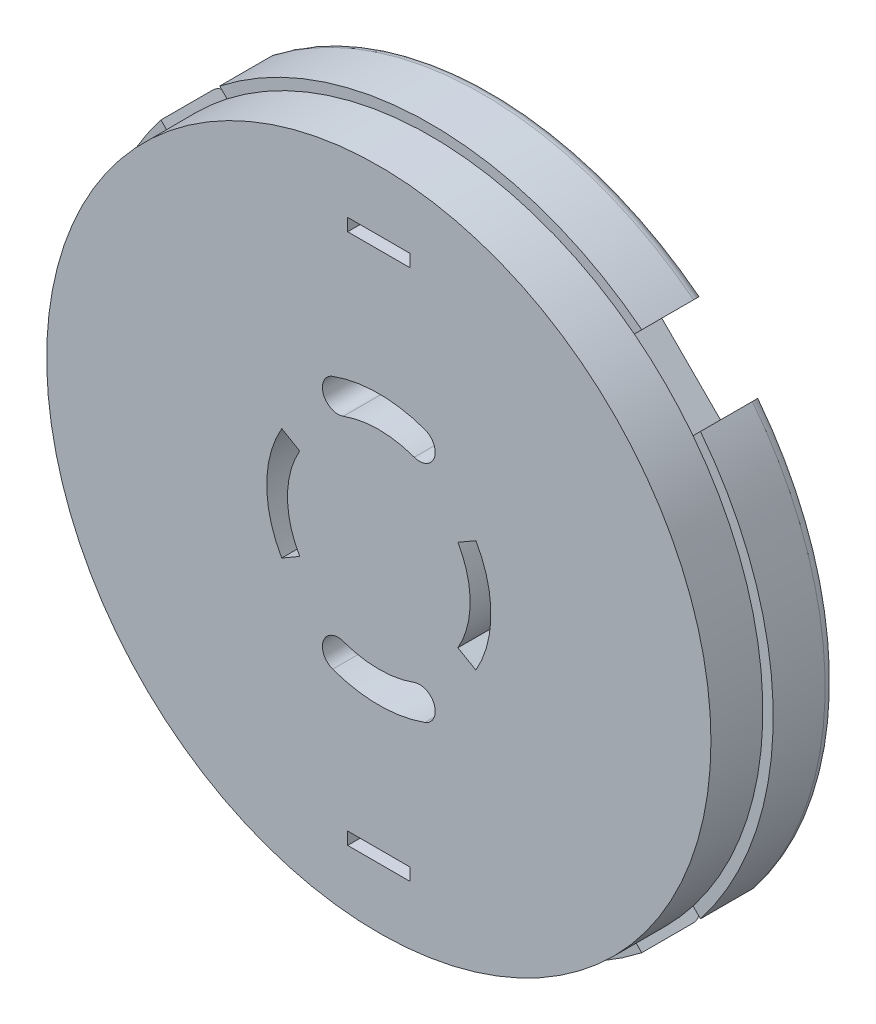
from build123d import *

# Parameters (mm, degrees)
SKETCH1_R           = 16.5
BOSS_EXTRUDE1_DEPTH = 3
SKETCH2_R           = 3.75
BOSS_EXTRUDE2_DEPTH = 3
CUT_EXTRUDE1_DEPTH  = 24.526580712
CIRPATTERN1_COUNT   = 4
SKETCH4_R           = 16
BOSS_EXTRUDE3_DEPTH = 2.5
CUT_EXTRUDE2_DEPTH  = 24.973944189
CIRPATTERN2_COUNT   = 2
CUT_EXTRUDE3_DEPTH  = 24.973944189
CIRPATTERN3_COUNT   = 2
SKETCH8_R           = 1.45
CUT_EXTRUDE4_DEPTH  = 0.5
SKETCH9_W           = 0.5
SKETCH9_H           = 2.9
EXTRUDE_THIN1_DEPTH = 0.5
SKETCH10_W          = 2.9
SKETCH10_H          = 0.5
EXTRUDE_THIN2_DEPTH = 0.5
SKETCH11_W          = 3
SKETCH11_H          = 0.6
CUT_EXTRUDE5_DEPTH  = 24.973944189
CIRPATTERN4_COUNT   = 2
FILLET1_R           = 0.1
FILLET2_R           = 0.5


with BuildPart() as part:
    # Sketch1 → Boss-Extrude1 (new body)
    with BuildSketch(Plane.XY):
        Circle(SKETCH1_R)
    extrude(amount=-BOSS_EXTRUDE1_DEPTH)

    # Sketch2 → Boss-Extrude2 (add)
    with BuildSketch(Plane(origin=(0, 0, -3), x_dir=(-1, 0, 0), z_dir=(0, 0, -1))):
        Circle(SKETCH2_R)
    extrude(amount=BOSS_EXTRUDE2_DEPTH)

    # Sketch3 → Cut-Extrude1 (cut, through all)
    with BuildSketch(Plane(origin=(0, 0, -3), x_dir=(-1, 0, 0), z_dir=(0, 0, -1))):
        Polygon((10.253048327, 13.081475452), (8.131727984, 10.960155108), (10.960155108, 8.131727984), (13.081475452, 10.253048327), align=None)
    cut_extrude1 = extrude(amount=-CUT_EXTRUDE1_DEPTH, mode=Mode.SUBTRACT)

    # CirPattern1: Cut-Extrude1 ×4 about axis
    cirpattern1_axis = Axis((0, 0, 0), (0, 0, 1))
    for i in range(1, CIRPATTERN1_COUNT):
        add(cut_extrude1.rotate(cirpattern1_axis, i * 360 / CIRPATTERN1_COUNT), mode=Mode.SUBTRACT)

    # Sketch4 → Boss-Extrude3 (add)
    with BuildSketch(Plane.XY):
        with Locations(Location((0, 0, 0), (0, 0, 217.819244219))):
            Circle(SKETCH4_R)
    extrude(amount=BOSS_EXTRUDE3_DEPTH)

    # Sketch6 → Cut-Extrude2 (cut, through all)
    with BuildSketch(Plane(origin=(0, 0, -3), x_dir=(-1, 0, 0), z_dir=(0, 0, -1))):
        with BuildLine():
            Line((-4.67653718, 2.7), (-3.810511777, 2.2))
            ThreePointArc((-3.810511777, 2.2), (-4.4, 0), (-3.810511777, -2.2))
            Line((-3.810511777, -2.2), (-4.67653718, -2.7))
            ThreePointArc((-4.67653718, -2.7), (-5.4, 0), (-4.67653718, 2.7))
        make_face()
    cut_extrude2 = extrude(amount=-CUT_EXTRUDE2_DEPTH, mode=Mode.SUBTRACT)

    # CirPattern2: Cut-Extrude2 ×2 about axis
    cirpattern2_axis = Axis((0, 0, 0), (0, 0, 1))
    for i in range(1, CIRPATTERN2_COUNT):
        add(cut_extrude2.rotate(cirpattern2_axis, i * 360 / CIRPATTERN2_COUNT), mode=Mode.SUBTRACT)

    # Sketch7 → Cut-Extrude3 (cut, through all)
    with BuildSketch(Plane(origin=(0, 0, -3), x_dir=(-1, 0, 0), z_dir=(0, 0, -1))):
        with BuildLine():
            ThreePointArc((2.223130932, 6.108002035), (0, 6.5), (-2.223130932, 6.108002035))
            ThreePointArc((-2.223130932, 6.108002035), (-2.67138529, 5.146717462), (-1.710100717, 4.698463104))
            ThreePointArc((-1.710100717, 4.698463104), (0, 5), (1.710100717, 4.698463104))
            ThreePointArc((1.710100717, 4.698463104), (2.67138529, 5.146717462), (2.223130932, 6.108002035))
        make_face()
    cut_extrude3 = extrude(amount=-CUT_EXTRUDE3_DEPTH, mode=Mode.SUBTRACT)

    # CirPattern3: Cut-Extrude3 ×2 about axis
    cirpattern3_axis = Axis((0, 0, 0), (0, 0, 1))
    for i in range(1, CIRPATTERN3_COUNT):
        add(cut_extrude3.rotate(cirpattern3_axis, i * 360 / CIRPATTERN3_COUNT), mode=Mode.SUBTRACT)

    # Sketch8 → Cut-Extrude4 (cut)
    with BuildSketch(Plane(origin=(0, 0, -3), x_dir=(-1, 0, 0), z_dir=(0, 0, -1))):
        with Locations((-7.071067812, 7.071067812)):
            Circle(SKETCH8_R)
        Polygon((8.485281374, -3.535533906), (3.535533906, -8.485281374), (5.656854249, -10.606601718), (10.606601718, -5.656854249), align=None)
    extrude(amount=-CUT_EXTRUDE4_DEPTH, mode=Mode.SUBTRACT)

    # Sketch9 → Extrude-Thin1 (add)
    with BuildSketch(Plane(origin=(0, 0, -2.5), x_dir=(-1, 0, 0), z_dir=(0, 0, -1))):
        with Locations((-7.071067812, 7.071067812)):
            Rectangle(SKETCH9_W, SKETCH9_H)
    extrude(amount=EXTRUDE_THIN1_DEPTH)

    # Sketch10 → Extrude-Thin2 (add)
    with BuildSketch(Plane(origin=(0, 0, -2.5), x_dir=(-1, 0, 0), z_dir=(0, 0, -1))):
        with Locations((-7.071067812, 7.071067812)):
            Rectangle(SKETCH10_W, SKETCH10_H)
    extrude(amount=EXTRUDE_THIN2_DEPTH)

    # Sketch11 → Cut-Extrude5 (cut, through all)
    with BuildSketch(Plane(origin=(0, 0, -3), x_dir=(-1, 0, 0), z_dir=(0, 0, -1))):
        with Locations((0, 12.8)):
            Rectangle(SKETCH11_W, SKETCH11_H)
    cut_extrude5 = extrude(amount=-CUT_EXTRUDE5_DEPTH, mode=Mode.SUBTRACT)

    # CirPattern4: Cut-Extrude5 ×2 about axis
    cirpattern4_axis = Axis((0, 0, 0), (0, 0, 1))
    for i in range(1, CIRPATTERN4_COUNT):
        add(cut_extrude5.rotate(cirpattern4_axis, i * 360 / CIRPATTERN4_COUNT), mode=Mode.SUBTRACT)

    # Fillet1
    fillet1_edges = [part.edges().sort_by_distance(p)[0] for p in [
        (3.75, 0, -3),
        (3.75, 0, -6),
    ]]
    fillet(fillet1_edges, radius=FILLET1_R)

    # Fillet2
    fillet2_edges = [part.edges().sort_by_distance(p)[0] for p in [
        (-16.5, 0, -3),
        (0, -16.5, -3),
        (16.5, 0, -3),
        (0, 16.5, -3),
    ]]
    fillet(fillet2_edges, radius=FILLET2_R)


solid = part.part
